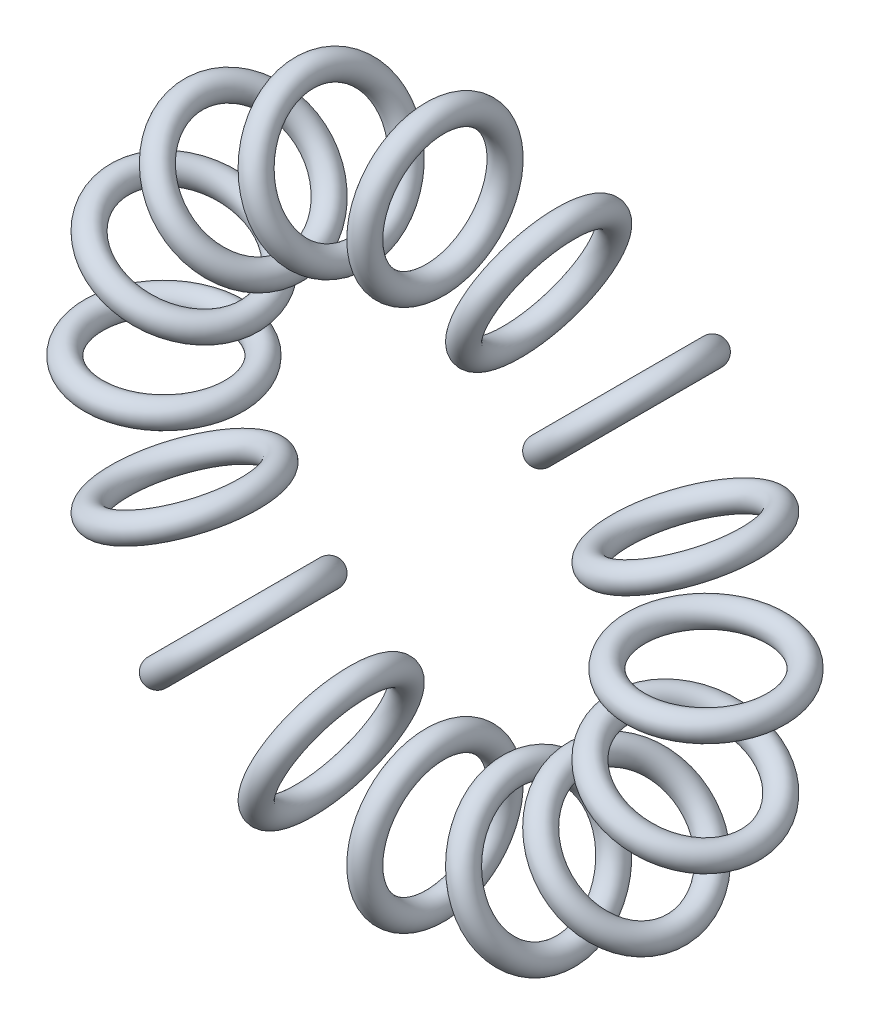
from build123d import *

# Parameters (mm, degrees)
ESBO_O1_R         = 1
CIRPATTERN1_COUNT = 16


with BuildPart() as part:
    # Esboço1 → Revolução1 (revolve)
    with BuildSketch(Plane.XY):
        with Locations((0, 15.75)):
            Circle(ESBO_O1_R)
    revolve(axis=Axis((0, 21.25, 0), (1, 0, 0)))


with BuildPart() as cirpattern1_1:
    # CirPattern1: pattern copy
    add(part.part.rotate(Axis((0, 0, 4.638026439), (0, 0, -1)), 1 * 360 / CIRPATTERN1_COUNT))


with BuildPart() as cirpattern1_2:
    # CirPattern1: pattern copy
    add(part.part.rotate(Axis((0, 0, 4.638026439), (0, 0, -1)), 2 * 360 / CIRPATTERN1_COUNT))


with BuildPart() as cirpattern1_3:
    # CirPattern1: pattern copy
    add(part.part.rotate(Axis((0, 0, 4.638026439), (0, 0, -1)), 3 * 360 / CIRPATTERN1_COUNT))


with BuildPart() as cirpattern1_4:
    # CirPattern1: pattern copy
    add(part.part.rotate(Axis((0, 0, 4.638026439), (0, 0, -1)), 4 * 360 / CIRPATTERN1_COUNT))


with BuildPart() as cirpattern1_5:
    # CirPattern1: pattern copy
    add(part.part.rotate(Axis((0, 0, 4.638026439), (0, 0, -1)), 5 * 360 / CIRPATTERN1_COUNT))


with BuildPart() as cirpattern1_6:
    # CirPattern1: pattern copy
    add(part.part.rotate(Axis((0, 0, 4.638026439), (0, 0, -1)), 6 * 360 / CIRPATTERN1_COUNT))


with BuildPart() as cirpattern1_7:
    # CirPattern1: pattern copy
    add(part.part.rotate(Axis((0, 0, 4.638026439), (0, 0, -1)), 7 * 360 / CIRPATTERN1_COUNT))


with BuildPart() as cirpattern1_8:
    # CirPattern1: pattern copy
    add(part.part.rotate(Axis((0, 0, 4.638026439), (0, 0, -1)), 8 * 360 / CIRPATTERN1_COUNT))


with BuildPart() as cirpattern1_9:
    # CirPattern1: pattern copy
    add(part.part.rotate(Axis((0, 0, 4.638026439), (0, 0, -1)), 9 * 360 / CIRPATTERN1_COUNT))


with BuildPart() as cirpattern1_10:
    # CirPattern1: pattern copy
    add(part.part.rotate(Axis((0, 0, 4.638026439), (0, 0, -1)), 10 * 360 / CIRPATTERN1_COUNT))


with BuildPart() as cirpattern1_11:
    # CirPattern1: pattern copy
    add(part.part.rotate(Axis((0, 0, 4.638026439), (0, 0, -1)), 11 * 360 / CIRPATTERN1_COUNT))


with BuildPart() as cirpattern1_12:
    # CirPattern1: pattern copy
    add(part.part.rotate(Axis((0, 0, 4.638026439), (0, 0, -1)), 12 * 360 / CIRPATTERN1_COUNT))


with BuildPart() as cirpattern1_13:
    # CirPattern1: pattern copy
    add(part.part.rotate(Axis((0, 0, 4.638026439), (0, 0, -1)), 13 * 360 / CIRPATTERN1_COUNT))


with BuildPart() as cirpattern1_14:
    # CirPattern1: pattern copy
    add(part.part.rotate(Axis((0, 0, 4.638026439), (0, 0, -1)), 14 * 360 / CIRPATTERN1_COUNT))


with BuildPart() as cirpattern1_15:
    # CirPattern1: pattern copy
    add(part.part.rotate(Axis((0, 0, 4.638026439), (0, 0, -1)), 15 * 360 / CIRPATTERN1_COUNT))


solid = Compound([part.part, cirpattern1_1.part, cirpattern1_2.part, cirpattern1_3.part, cirpattern1_4.part, cirpattern1_5.part, cirpattern1_6.part, cirpattern1_7.part, cirpattern1_8.part, cirpattern1_9.part, cirpattern1_10.part, cirpattern1_11.part, cirpattern1_12.part, cirpattern1_13.part, cirpattern1_14.part, cirpattern1_15.part])
